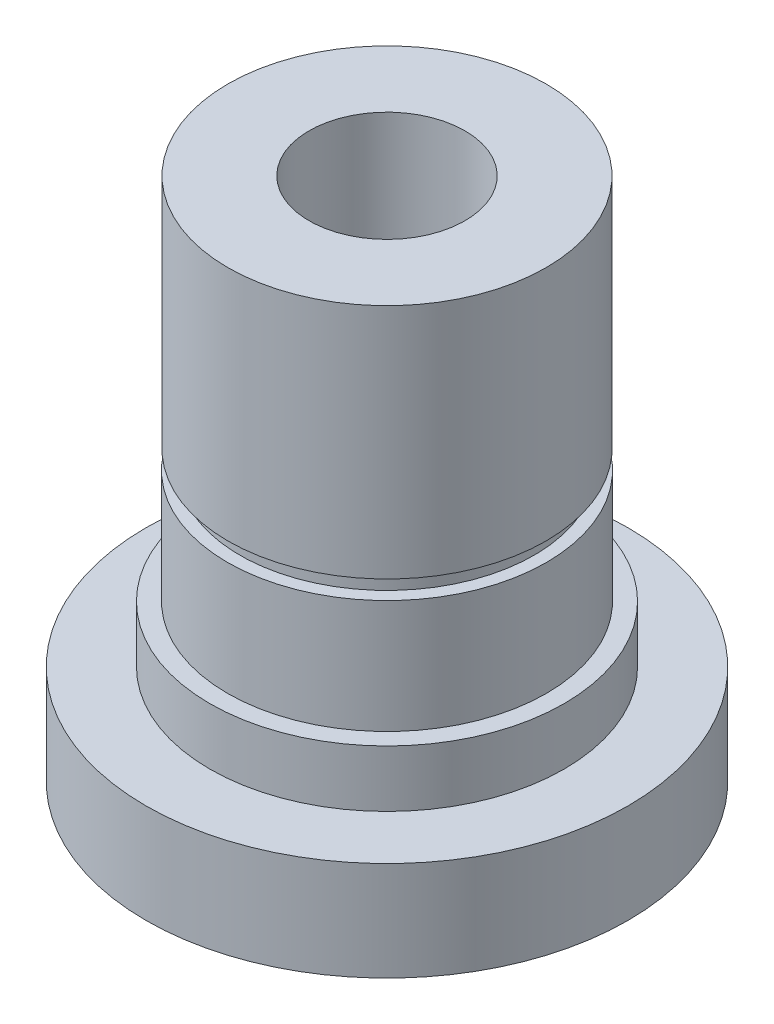
from build123d import *


with BuildPart() as part:
    # Sketch1 → Revolve1 (revolve)
    with BuildSketch(Plane.XY, mode=Mode.PRIVATE) as revolve1_sk:
        Polygon((-6, 0), (-34, 0), (-34, 14), (-25, 14), (-25, 74), (-11, 74), (-11, 30), (-3.25, 30), (-3.25, 10), (-6, 10), align=None)
    revolve(revolve1_sk.sketch.rotate(Axis((0, 0, 0), (0, 1, 0)), 270), axis=Axis((0, 0, 0), (0, 1, 0)))

    # Sketch3 → Cut-Revolve1 (revolve, cut)
    with BuildSketch(Plane.XY, mode=Mode.PRIVATE) as cut_revolve1_sk:
        Polygon((22.45, 74), (22.45, 40.6), (20.75, 40.6), (20.75, 38), (22.5, 38), (22.5, 22), (25, 22), (25, 74), align=None)
    revolve(cut_revolve1_sk.sketch.rotate(Axis((0, 0, 0), (0, 1, 0)), 90), axis=Axis((0, 0, 0), (0, 1, 0)), mode=Mode.SUBTRACT)


solid = part.part
